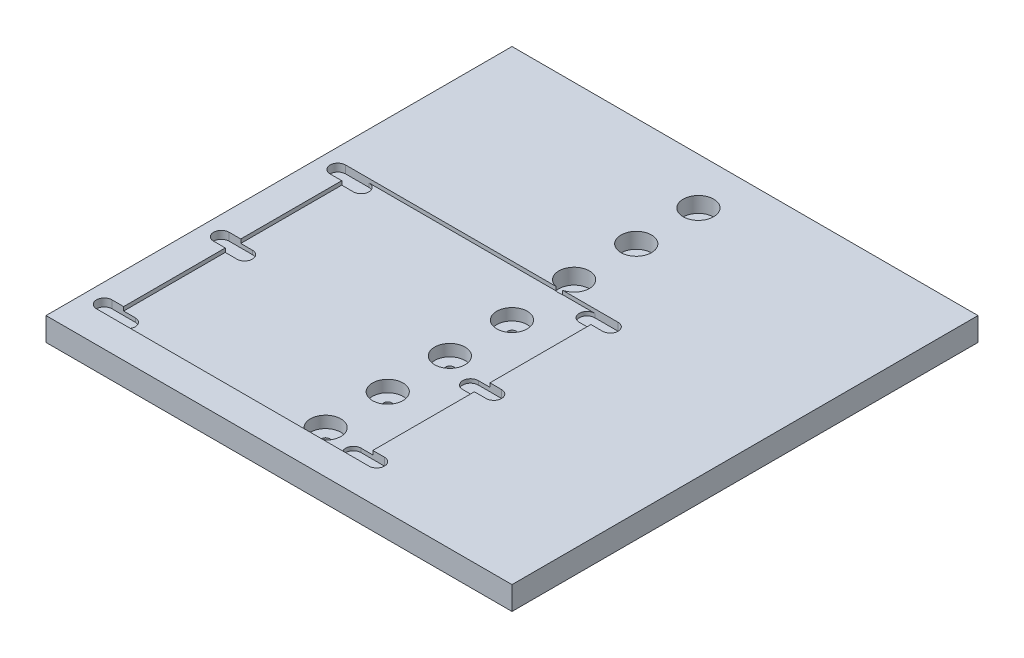
from build123d import *

# Parameters (mm, degrees)
SKETCH2_W         = 381
SKETCH2_H         = 381
SKETCH2_R         = 3.3782
BOLT_HOLES_DEPTH  = 19.05
SKETCH3_R         = 12.5
COUNTERBORE_DEPTH = 12.7
SKETCH4_W         = 203.708
SKETCH4_H         = 203.708
AL_POCKET_DEPTH   = 3.175
RELIEF_DEPTH      = 6.35


with BuildPart() as part:
    # Sketch2 → Bolt Holes (new body)
    with BuildSketch(Plane(origin=(0, 0, 0), x_dir=(1, 0, 0), z_dir=(0, 1, 0))):
        Rectangle(SKETCH2_W, SKETCH2_H)
        with Locations(Location((0, 0, 0), (0, 0, 90))):
            Circle(SKETCH2_R, mode=Mode.SUBTRACT)
        with Locations(Location((0, 50.8, 0), (0, 0, 90))):
            Circle(SKETCH2_R, mode=Mode.SUBTRACT)
        with Locations(Location((0, 101.6, 0), (0, 0, 90))):
            Circle(SKETCH2_R, mode=Mode.SUBTRACT)
        with Locations(Location((0, 152.4, 0), (0, 0, 90))):
            Circle(SKETCH2_R, mode=Mode.SUBTRACT)
        with Locations(Location((0, -50.8, 0), (0, 0, 90))):
            Circle(SKETCH2_R, mode=Mode.SUBTRACT)
        with Locations(Location((0, -101.6, 0), (0, 0, 90))):
            Circle(SKETCH2_R, mode=Mode.SUBTRACT)
        with Locations(Location((0, -152.4, 0), (0, 0, 90))):
            Circle(SKETCH2_R, mode=Mode.SUBTRACT)
    extrude(amount=BOLT_HOLES_DEPTH)

    # Sketch3 → Counterbore (cut)
    with BuildSketch(Plane(origin=(0, 19.05, 0), x_dir=(1, 0, 0), z_dir=(0, 1, 0))):
        with Locations(Location((0, -50.8, 0), (0, 0, 270))):
            Circle(SKETCH3_R)
        with Locations(Location((0, 0, 0), (0, 0, 270))):
            Circle(SKETCH3_R)
        with Locations(Location((0, -101.6, 0), (0, 0, 270))):
            Circle(SKETCH3_R)
        with Locations(Location((0, 50.8, 0), (0, 0, 270))):
            Circle(SKETCH3_R)
        with Locations(Location((0, 101.6, 0), (0, 0, 270))):
            Circle(SKETCH3_R)
        with Locations(Location((0, 152.4, 0), (0, 0, 270))):
            Circle(SKETCH3_R)
        with Locations(Location((0, -152.4, 0), (0, 0, 270))):
            Circle(SKETCH3_R)
    extrude(amount=-COUNTERBORE_DEPTH, mode=Mode.SUBTRACT)

    # Sketch4 → al_pocket (cut)
    with BuildSketch(Plane(origin=(0, 19.05, 0), x_dir=(1, 0, 0), z_dir=(0, 1, 0))):
        with Locations((-63.246, -63.246)):
            Rectangle(SKETCH4_W, SKETCH4_H)
    extrude(amount=-AL_POCKET_DEPTH, mode=Mode.SUBTRACT)

    # Sketch5 → Relief (cut)
    with BuildSketch(Plane(origin=(0, 19.05, 0), x_dir=(1, 0, 0), z_dir=(0, 1, 0))):
        with BuildLine():
            Line((-174.625, 38.608), (-155.575, 38.608))
            ThreePointArc((-155.575, 38.608), (-149.225, 32.258), (-155.575, 25.908))
            Line((-155.575, 25.908), (-174.625, 25.908))
            ThreePointArc((-174.625, 25.908), (-180.975, 32.258), (-174.625, 38.608))
        make_face()
        with BuildLine():
            Line((-174.625, -152.4), (-155.575, -152.4))
            ThreePointArc((-155.575, -152.4), (-149.225, -158.75), (-155.575, -165.1))
            Line((-155.575, -165.1), (-174.625, -165.1))
            ThreePointArc((-174.625, -165.1), (-180.975, -158.75), (-174.625, -152.4))
        make_face()
        with BuildLine():
            Line((-174.625, -56.642), (-155.575, -56.642))
            ThreePointArc((-155.575, -56.642), (-149.225, -62.992), (-155.575, -69.342))
            Line((-155.575, -69.342), (-174.625, -69.342))
            ThreePointArc((-174.625, -69.342), (-180.975, -62.992), (-174.625, -56.642))
        make_face()
        with BuildLine():
            Line((29.083, 38.608), (48.133, 38.608))
            ThreePointArc((48.133, 38.608), (54.483, 32.258), (48.133, 25.908))
            Line((48.133, 25.908), (29.083, 25.908))
            ThreePointArc((29.083, 25.908), (22.733, 32.258), (29.083, 38.608))
        make_face()
        with BuildLine():
            Line((29.083, -152.4), (48.133, -152.4))
            ThreePointArc((48.133, -152.4), (54.483, -158.75), (48.133, -165.1))
            Line((48.133, -165.1), (29.083, -165.1))
            ThreePointArc((29.083, -165.1), (22.733, -158.75), (29.083, -152.4))
        make_face()
        with BuildLine():
            Line((29.083, -56.642), (48.133, -56.642))
            ThreePointArc((48.133, -56.642), (54.483, -62.992), (48.133, -69.342))
            Line((48.133, -69.342), (29.083, -69.342))
            ThreePointArc((29.083, -69.342), (22.733, -62.992), (29.083, -56.642))
        make_face()
    extrude(amount=-RELIEF_DEPTH, mode=Mode.SUBTRACT)


solid = part.part
